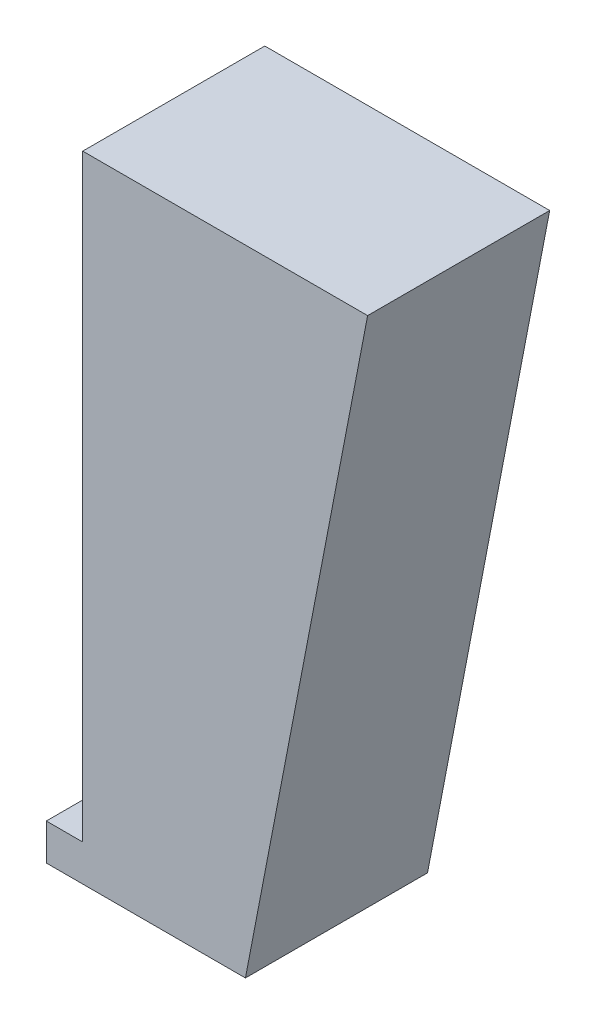
from build123d import *

# Parameters (mm, degrees)
BOSS_EXTRUDE1_DEPTH = 35


with BuildPart() as part:
    # Sketch1 → Boss-Extrude1 (new body)
    with BuildSketch(Plane.XY):
        Polygon((-6.022186833, 12.5), (0.977813167, 12.5), (0.977813167, 127.522203292), (55.743820575, 127.522203292), (32.255552115, 5.5), (-6.022186833, 5.5), align=None)
    extrude(amount=BOSS_EXTRUDE1_DEPTH)


solid = part.part
